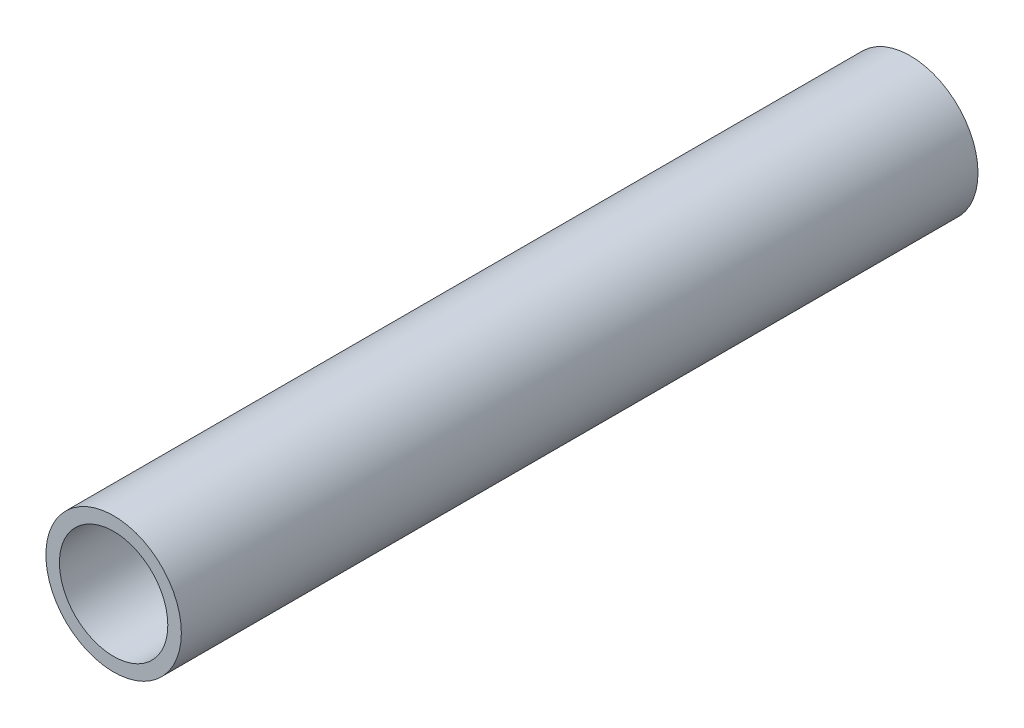
from build123d import *

# Parameters (mm, degrees)
SKETCH1_R      = 1.25
SKETCH1_R_2    = 1
EXTRUDE1_DEPTH = 14.7


with BuildPart() as part:
    # Sketch1 → Extrude1 (new body)
    with BuildSketch(Plane.XY):
        Circle(SKETCH1_R)
        Circle(SKETCH1_R_2, mode=Mode.SUBTRACT)
    extrude(amount=-EXTRUDE1_DEPTH)


solid = part.part
